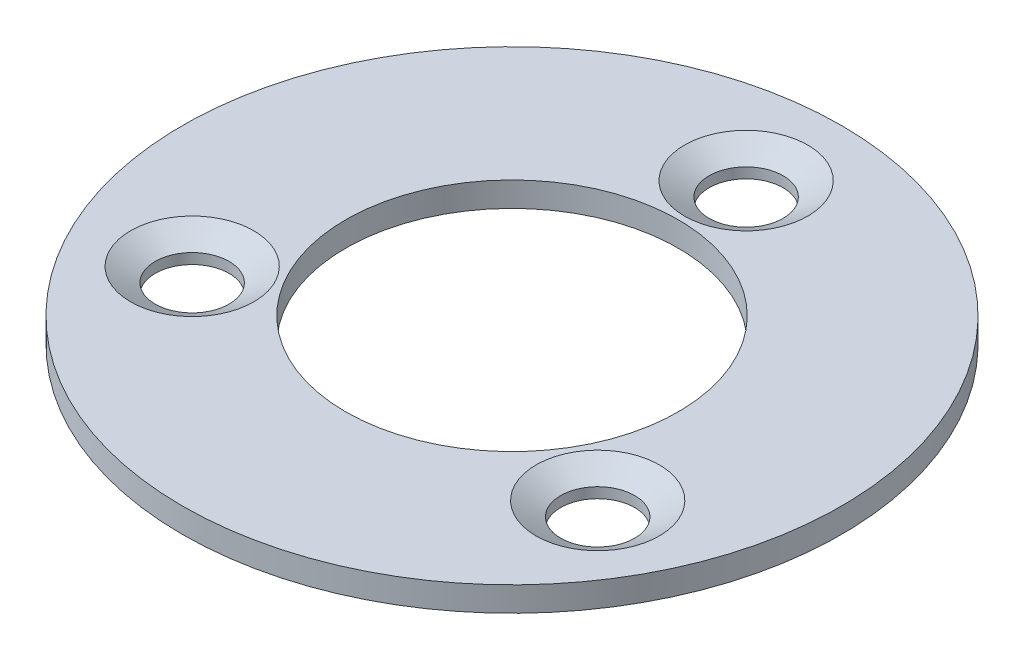
from build123d import *

# Parameters (mm, degrees)
SKETCH_1_R          = 13.371753228
SKETCH_1_R_2        = 6.75
EXTRUDE_1_DEPTH     = 1
SKETCH_2_R          = 1.5
CUT_EXTRUDE_1_DEPTH = 2
CHAMFER_1_SIZE      = 1
CHAMFER_1_SIZE2     = 0.577350269


with BuildPart() as part:
    # 草图1 → 凸台-拉伸1 (new body)
    with BuildSketch(Plane(origin=(0, 0, 0), x_dir=(1, 0, 0), z_dir=(0, 1, 0))):
        with Locations(Location((0, 0, 0), (0, 0, 270))):
            Circle(SKETCH_1_R)
        with Locations(Location((0, 0, 0), (0, 0, 270))):
            Circle(SKETCH_1_R_2, mode=Mode.SUBTRACT)
    extrude(amount=EXTRUDE_1_DEPTH)

    # 草图2 → 切除-拉伸1 (cut)
    with BuildSketch(Plane(origin=(0, 1, 0), x_dir=(1, 0, 0), z_dir=(0, 1, 0))):
        with Locations(Location((0, 9.5, 0), (0, 0, 270))):
            Circle(SKETCH_2_R)
        with Locations(Location((8.227241336, -4.75, 0), (0, 0, 270))):
            Circle(SKETCH_2_R)
        with Locations(Location((-8.227241336, -4.75, 0), (0, 0, 270))):
            Circle(SKETCH_2_R)
    extrude(amount=-CUT_EXTRUDE_1_DEPTH, mode=Mode.SUBTRACT)

    # 倒角1
    chamfer_1_edges = [part.edges().sort_by_distance(p)[0] for p in [
        (0, 1, -11),
        (8.227241336, 1, 3.25),
        (-8.227241336, 1, 3.25),
    ]]
    chamfer_1_side = [part.faces().sort_by_distance(p)[0] for p in [
        (0, 1, -12.993542933),
    ]]
    chamfer(chamfer_1_edges, length=CHAMFER_1_SIZE, length2=CHAMFER_1_SIZE2, reference=chamfer_1_side[0])


solid = part.part
